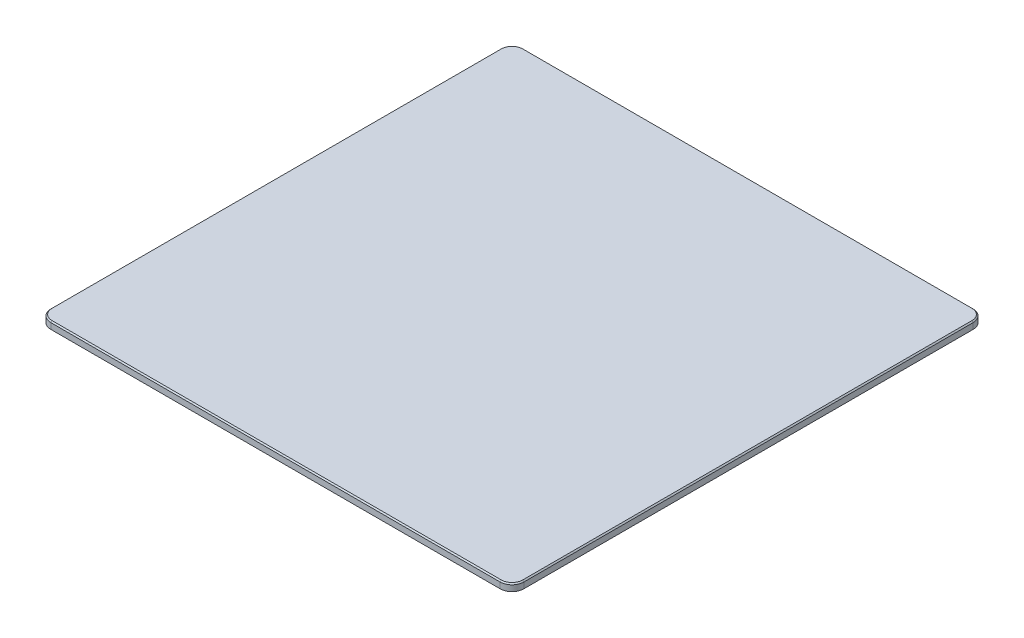
from build123d import *

# Parameters (mm, degrees)
CROQUIS1_W              = 200
CROQUIS1_H              = 200
SALIENTE_EXTRUIR1_DEPTH = 3
REDONDEO1_R             = 5
CHAFL_N1_SIZE           = 0.5


with BuildPart() as part:
    # Croquis1 → Saliente-Extruir1 (new body)
    with BuildSketch(Plane(origin=(0, 0, 0), x_dir=(1, 0, 0), z_dir=(0, 1, 0))):
        Rectangle(CROQUIS1_W, CROQUIS1_H)
    extrude(amount=SALIENTE_EXTRUIR1_DEPTH)

    # Redondeo1
    redondeo1_edges = [part.edges().sort_by_distance(p)[0] for p in [
        (100, 1.5, 100),
        (-100, 1.5, 100),
        (-100, 1.5, -100),
        (100, 1.5, -100),
    ]]
    fillet(redondeo1_edges, radius=REDONDEO1_R)

    # Chaflán1
    chafl_n1_edges = [part.edges().sort_by_distance(p)[0] for p in [
        (-100, 3, 0),
        (0, 3, -100),
        (100, 3, 0),
        (0, 3, 100),
        (-98.535533906, 3, 98.535533906),
        (98.535533906, 3, 98.535533906),
        (98.535533906, 3, -98.535533906),
        (-98.535533906, 3, -98.535533906),
    ]]
    chamfer(chafl_n1_edges, length=CHAFL_N1_SIZE)


solid = part.part
